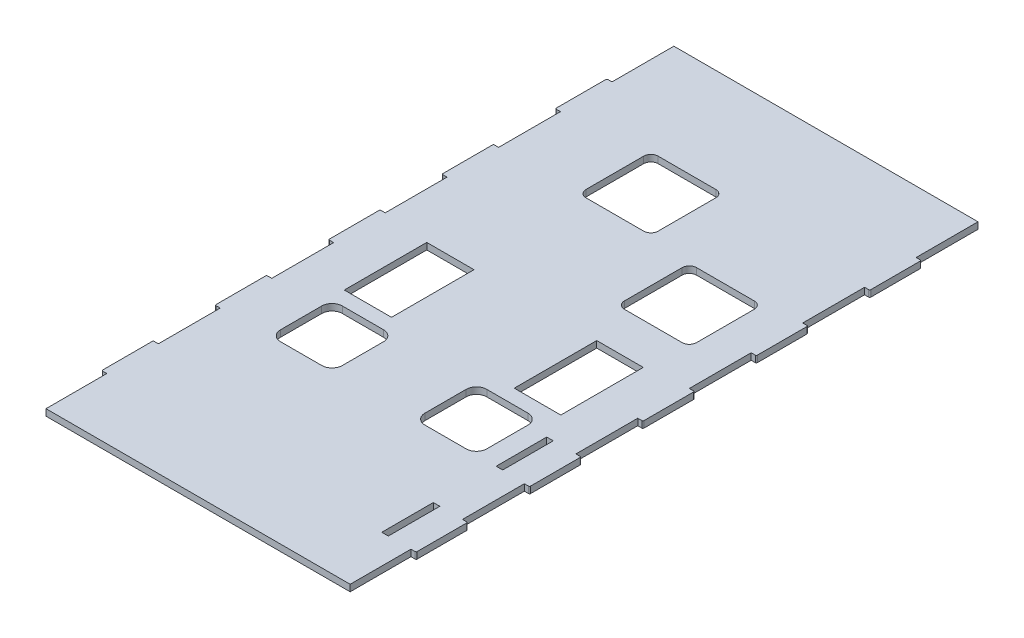
from build123d import *

# Parameters (mm, degrees)
SKETCH1_W           = 6.35
SKETCH1_H           = 50
SKETCH1_H_2         = 49
SKETCH1_W_2         = 45.825573982
SKETCH1_H_3         = 80
SKETCH1_W_3         = 45.139685757
BOSS_EXTRUDE1_DEPTH = 6.35
FILLET1_R           = 1


with BuildPart() as part:
    # Sketch1 → Boss-Extrude1 (new body)
    with BuildSketch(Plane(origin=(0, 0, 0), x_dir=(1, 0, 0), z_dir=(0, 1, 0))):
        Polygon((157.073624904, 348.621301775), (157.073624902, 288.621301775), (162.073624902, 288.621300264), (162.085917882, 238.621301775), (157.085917882, 238.621301775), (157.085917882, 178.621301775), (162.085917882, 178.621301775), (162.085917882, 128.621301775), (157.085917882, 128.621301775), (157.085917882, 68.621301775), (162.085917882, 68.621301775), (162.085917882, 18.621301775), (157.085917882, 18.621301775), (157.085917882, -41.378698225), (162.085917882, -41.378698225), (162.085917882, -91.378698225), (157.085917882, -91.378698225), (157.085917882, -151.378698225), (162.085917882, -151.378698225), (162.085917882, -201.378698225), (157.085917882, -201.378698225), (157.085917882, -260.378698225), (-137.926375098, -260.378698225), (-137.926375098, -201.378698225), (-142.938668078, -201.378698225), (-142.938668078, -151.378698225), (-137.926375098, -151.378698225), (-137.926375098, -91.378698225), (-142.926375098, -91.378698225), (-142.926375098, -41.378698225), (-137.926375098, -41.378698225), (-137.926375098, 18.621301775), (-142.938668078, 18.621301775), (-142.938668078, 68.621301775), (-137.926375098, 68.621301775), (-137.926375098, 128.621301775), (-142.938668078, 128.621301775), (-142.938668078, 178.621301775), (-137.926375098, 178.621301775), (-137.926375098, 238.621301775), (-142.938668078, 238.621301775), (-142.938668078, 288.621301775), (-137.926375096, 288.621301775), (-137.926375096, 348.621301775), align=None)
        with BuildLine():
            Line((-80.468838102, -30.378698225), (-40.468838102, -30.378698225))
            ThreePointArc((-40.468838102, -30.378698225), (-33.39777029, -33.307630413), (-30.468838102, -40.378698225))
            Line((-30.468838102, -40.378698225), (-30.468838102, -80.378698225))
            ThreePointArc((-30.468838102, -80.378698225), (-33.39777029, -87.449766037), (-40.468838102, -90.378698225))
            Line((-40.468838102, -90.378698225), (-80.468838102, -90.378698225))
            ThreePointArc((-80.468838102, -90.378698225), (-87.539905914, -87.449766037), (-90.468838102, -80.378698225))
            Line((-90.468838102, -80.378698225), (-90.468838102, -40.378698225))
            ThreePointArc((-90.468838102, -40.378698225), (-87.539905914, -33.307630413), (-80.468838102, -30.378698225))
        make_face(mode=Mode.SUBTRACT)
        with BuildLine():
            Line((59.585917882, -30.378698225), (99.585917882, -30.378698225))
            ThreePointArc((99.585917882, -30.378698225), (106.656985694, -33.307630413), (109.585917882, -40.378698225))
            Line((109.585917882, -40.378698225), (109.585917882, -80.378698225))
            ThreePointArc((109.585917882, -80.378698225), (106.656985694, -87.449766037), (99.585917882, -90.378698225))
            Line((99.585917882, -90.378698225), (59.585917882, -90.378698225))
            ThreePointArc((59.585917882, -90.378698225), (52.51485007, -87.449766037), (49.585917882, -80.378698225))
            Line((49.585917882, -80.378698225), (49.585917882, -40.378698225))
            ThreePointArc((49.585917882, -40.378698225), (52.51485007, -33.307630413), (59.585917882, -30.378698225))
        make_face(mode=Mode.SUBTRACT)
        with Locations((131.910917882, -176.378698225)):
            Rectangle(SKETCH1_W, SKETCH1_H, mode=Mode.SUBTRACT)
        with Locations((131.910917882, -65.878698225)):
            Rectangle(SKETCH1_W, SKETCH1_H_2, mode=Mode.SUBTRACT)
        with BuildLine():
            Line((-53.19802656, 248.621301775), (2.80197344, 248.621301775))
            ThreePointArc((2.80197344, 248.621301775), (7.751720908, 246.571049243), (9.80197344, 241.621301775))
            Line((9.80197344, 241.621301775), (9.80197344, 185.621301775))
            ThreePointArc((9.80197344, 185.621301775), (7.751720908, 180.671554307), (2.80197344, 178.621301775))
            Line((2.80197344, 178.621301775), (-53.198026561, 178.621301775))
            ThreePointArc((-53.198026561, 178.621301775), (-58.147774029, 180.671554307), (-60.198026561, 185.621301775))
            Line((-60.198026561, 185.621301775), (-60.19802656, 241.621301775))
            ThreePointArc((-60.19802656, 241.621301775), (-58.147774029, 246.571049243), (-53.19802656, 248.621301775))
        make_face(mode=Mode.SUBTRACT)
        with BuildLine():
            Line((59.085917882, 173.621301775), (115.085917882, 173.621301775))
            ThreePointArc((115.085917882, 173.621301775), (120.03566535, 171.571049243), (122.085917882, 166.621301775))
            Line((122.085917882, 166.621301775), (122.085917882, 110.621301775))
            ThreePointArc((122.085917882, 110.621301775), (120.03566535, 105.671554307), (115.085917882, 103.621301775))
            Line((115.085917882, 103.621301775), (59.085917882, 103.621301775))
            ThreePointArc((59.085917882, 103.621301775), (54.136170414, 105.671554307), (52.085917882, 110.621301775))
            Line((52.085917882, 110.621301775), (52.085917882, 166.621301775))
            ThreePointArc((52.085917882, 166.621301775), (54.136170414, 171.571049243), (59.085917882, 173.621301775))
        make_face(mode=Mode.SUBTRACT)
        with Locations((-70.013588107, 23.936670646)):
            Rectangle(SKETCH1_W_2, SKETCH1_H_3, mode=Mode.SUBTRACT)
        with Locations((94.516075004, 23.936670646)):
            Rectangle(SKETCH1_W_3, SKETCH1_H_3, mode=Mode.SUBTRACT)
    extrude(amount=BOSS_EXTRUDE1_DEPTH)

    # Fillet1
    fillet1_edges = [part.edges().sort_by_distance(p)[0] for p in [
        (162.073624902, 3.175, -288.621300264),
        (162.085917882, 3.175, -238.621301775),
        (162.085917882, 3.175, -178.621301775),
        (162.085917882, 3.175, -128.621301775),
        (162.085917882, 3.175, -68.621301775),
        (162.085917882, 3.175, -18.621301775),
        (162.085917882, 3.175, 41.378698225),
        (162.085917882, 3.175, 91.378698225),
        (162.085917882, 3.175, 151.378698225),
        (162.085917882, 3.175, 201.378698225),
        (-142.938668078, 3.175, 201.378698225),
        (-142.938668078, 3.175, 151.378698225),
        (-142.926375098, 3.175, 91.378698225),
        (-142.926375098, 3.175, 41.378698225),
        (-142.938668078, 3.175, -18.621301775),
        (-142.938668078, 3.175, -68.621301775),
        (-142.938668078, 3.175, -128.621301775),
        (-142.938668078, 3.175, -178.621301775),
        (-142.938668078, 3.175, -238.621301775),
        (-142.938668078, 3.175, -288.621301775),
    ]]
    fillet(fillet1_edges, radius=FILLET1_R)


solid = part.part
